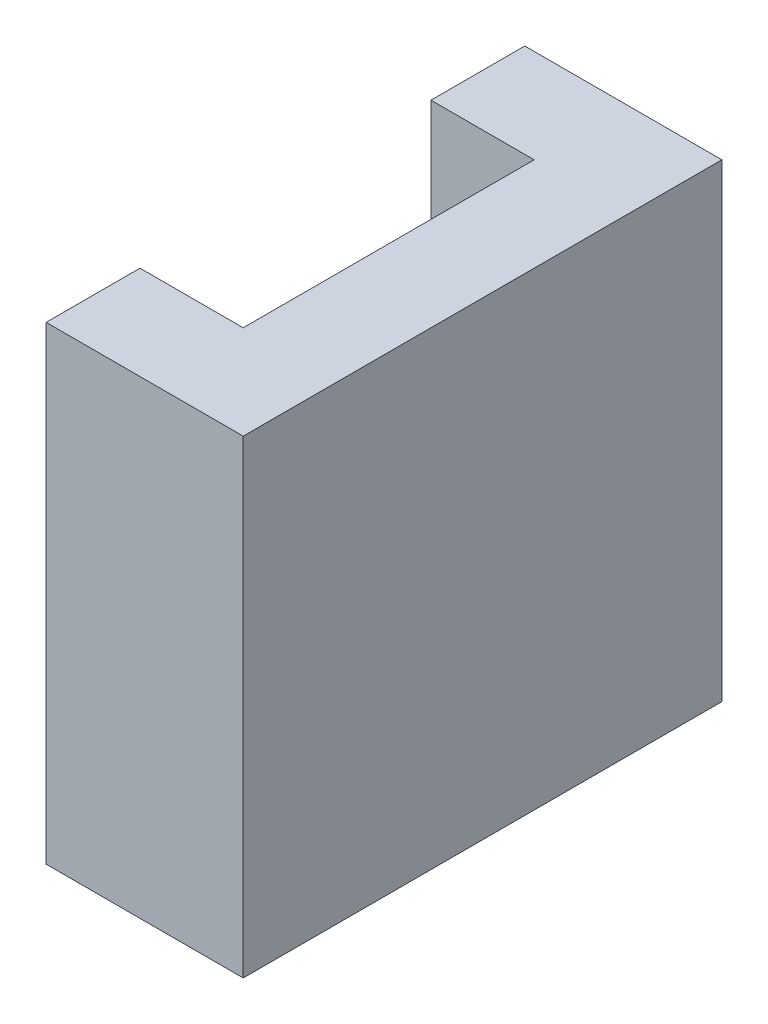
from build123d import *

# Parameters (mm, degrees)
BOSS_EXTRUDE1_DEPTH = 5.5
SKETCH2_W           = 25.5
SKETCH2_H           = 25
BOSS_EXTRUDE2_DEPTH = 5


with BuildPart() as part:
    # Sketch1 → Boss-Extrude1 (new body)
    with BuildSketch(Plane(origin=(0, 0, 0), x_dir=(0, 0, -1), z_dir=(1, 0, 0))):
        Polygon((-14.845360825, -6.858679442), (-14.845360825, 13.141320558), (-19.845360825, 13.141320558), (-19.845360825, -11.858679442), (5.654639175, -11.858679442), (5.654639175, 13.141320558), (0.654639175, 13.141320558), (0.654639175, -6.858679442), align=None)
    extrude(amount=BOSS_EXTRUDE1_DEPTH)

    # Sketch2 → Boss-Extrude2 (add)
    with BuildSketch(Plane(origin=(5.5, 0, 0), x_dir=(0, 0, -1), z_dir=(1, 0, 0))):
        with Locations((-7.095360825, 0.641320558)):
            Rectangle(SKETCH2_W, SKETCH2_H)
    extrude(amount=BOSS_EXTRUDE2_DEPTH)


solid = part.part
